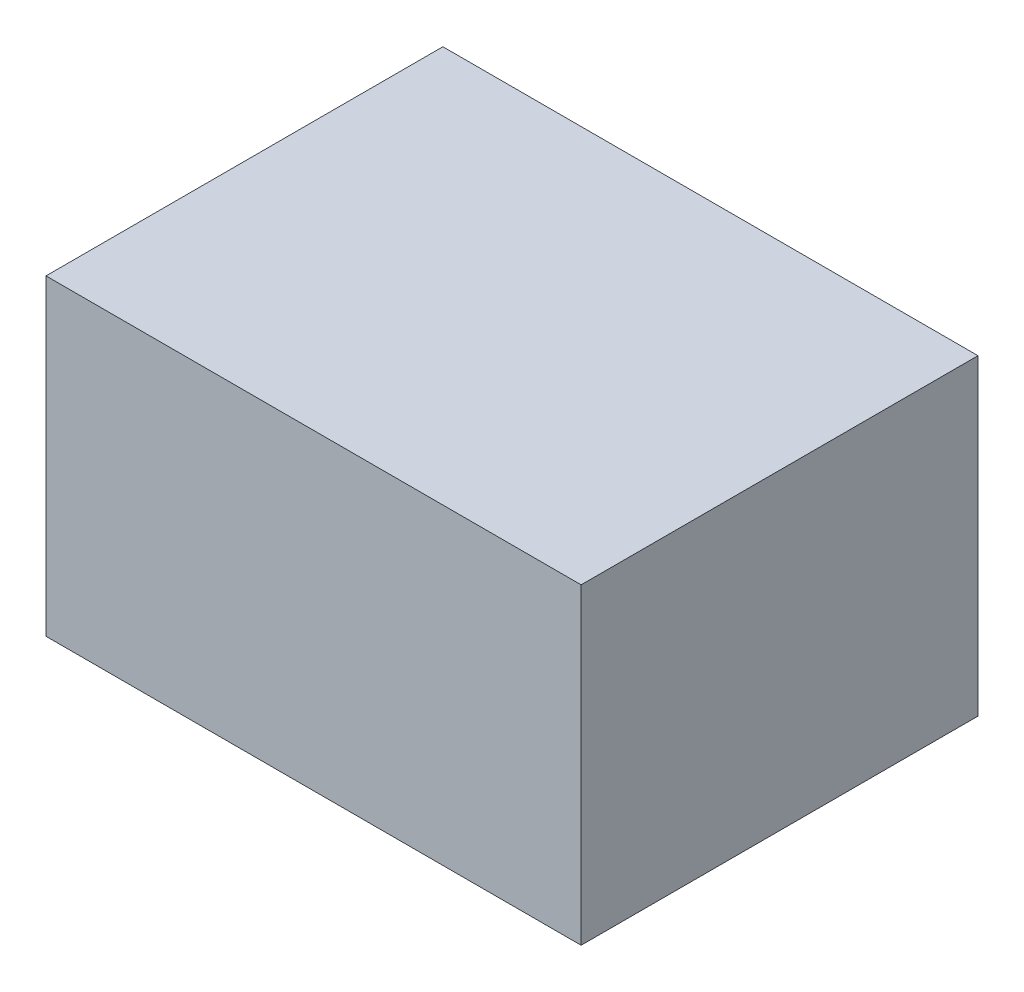
from build123d import *

# Parameters (mm, degrees)
SKETCH1_W           = 600
SKETCH1_H           = 350
BOSS_EXTRUDE1_DEPTH = 445


with BuildPart() as part:
    # Sketch1 → Boss-Extrude1 (new body)
    with BuildSketch(Plane.XY):
        with Locations((300, 175)):
            Rectangle(SKETCH1_W, SKETCH1_H)
    extrude(amount=-BOSS_EXTRUDE1_DEPTH)


solid = part.part
